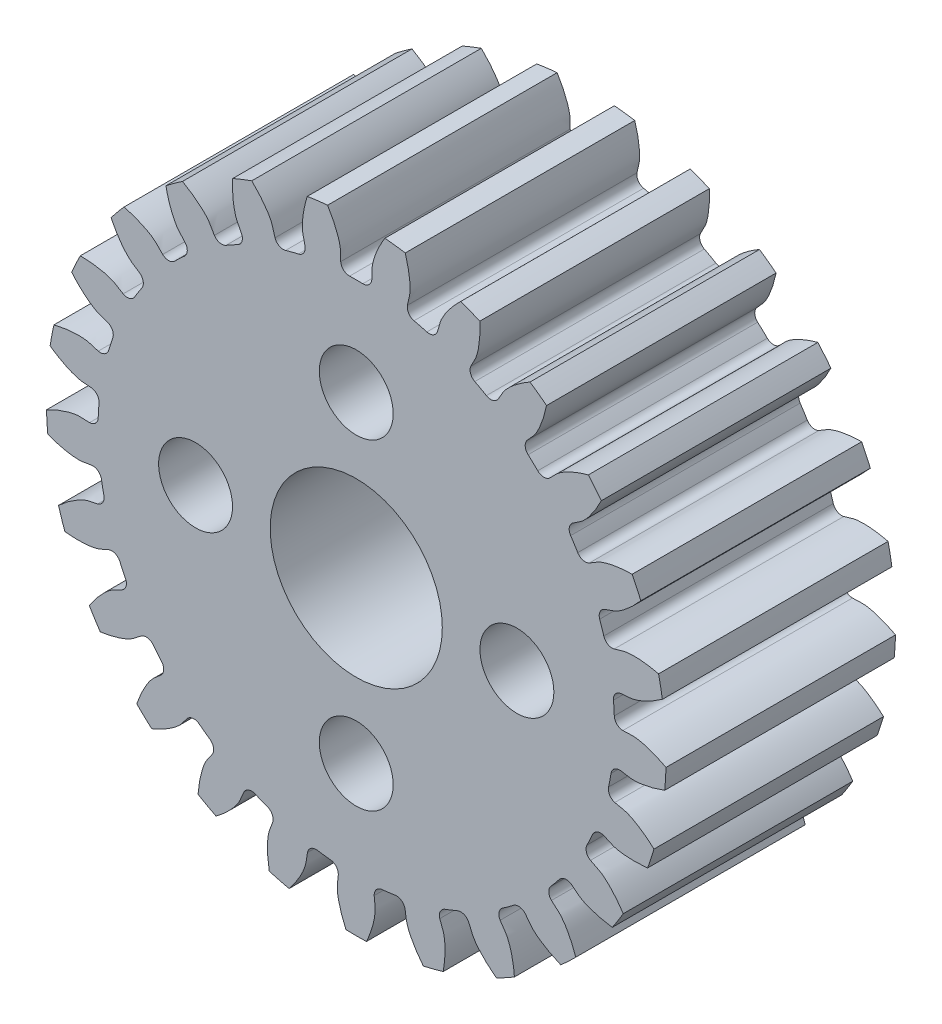
from build123d import *

# Parameters (mm, degrees)
SKETCH_1_R          = 13.5
LASHENA_DEPTH       = 10
CUT_EXTRUDEA_DEPTH  = 10
WWW_KYTOOL_CN_COUNT = 25
SKETCH_4_R          = 1.61
SKETCH_4_R_2        = 3.75
CUT_EXTRUDE_2_DEPTH = 10


with BuildPart() as part:
    # 草图1 → LaShenA (new body)
    with BuildSketch(Plane.XY):
        Circle(SKETCH_1_R)
    extrude(amount=LASHENA_DEPTH)

    # SketchA → Cut-ExtrudeA (cut)
    with BuildSketch(Plane.XY.offset(10)):
        with BuildLine():
            ThreePointArc((0.288394628, 11.246302883), (0, 11.25), (-0.288394628, 11.246302883))
            ThreePointArc((-0.288394628, 11.246302883), (-0.552990639, 11.344310851), (-0.677069573, 11.597729534))
            add(Edge.make_bspline(
                [(-0.677069573, 11.597729534), (-0.689180647, 11.759049046), (-0.675017357, 11.948139938), (-0.701115694, 12.146608536), (-0.710822654, 12.197973541), (-0.719381598, 12.238698758), (-0.730363593, 12.285443467), (-0.744009318, 12.338124262), (-0.760609842, 12.39663686), (-0.780435504, 12.460870991), (-0.803758566, 12.530705706), (-0.830845636, 12.606011004), (-0.861959653, 12.68664748), (-0.897358901, 12.772466597), (-0.937296937, 12.863310771), (-0.982022255, 12.959013534), (-1.031778021, 13.059399677), (-1.086801808, 13.164285408), (-1.147325325, 13.273478522), (-1.213574156, 13.386778576), (-1.285767526, 13.503977062), (-1.364117951, 13.62485761), (-1.479472427, 13.794169673), (-1.572316715, 13.920638011), (-1.637338255, 14.005233377)],
                knots=[0.123705737, 0.123705737, 0.123705737, 0.123705737, 0.284026838, 0.310496331, 0.322146932, 0.335915822, 0.351803004, 0.369808477, 0.38993224, 0.412174294, 0.436534639, 0.463013274, 0.491610201, 0.522325418, 0.555158926, 0.590110724, 0.627180814, 0.666369194, 0.707675866, 0.751100828, 0.796644081, 0.844305624, 0.894085459, 1, 1, 1, 1], degree=3))
            ThreePointArc((-1.637338255, 14.005233377), (0, 14.100618373), (1.637338255, 14.005233377))
            add(Edge.make_bspline(
                [(0.677069573, 11.597729534), (0.689180647, 11.759049046), (0.675017357, 11.948139938), (0.701115694, 12.146608536), (0.710822654, 12.197973541), (0.719381598, 12.238698758), (0.730363593, 12.285443467), (0.744009318, 12.338124262), (0.760609842, 12.39663686), (0.780435504, 12.460870991), (0.803758566, 12.530705706), (0.830845636, 12.606011004), (0.861959653, 12.68664748), (0.897358901, 12.772466597), (0.937296937, 12.863310771), (0.982022255, 12.959013534), (1.031778021, 13.059399677), (1.086801808, 13.164285408), (1.147325325, 13.273478522), (1.213574156, 13.386778576), (1.285767526, 13.503977062), (1.364117951, 13.62485761), (1.479472427, 13.794169673), (1.572316715, 13.920638011), (1.637338255, 14.005233377)],
                knots=[0.123705737, 0.123705737, 0.123705737, 0.123705737, 0.284026838, 0.310496331, 0.322146932, 0.335915822, 0.351803004, 0.369808477, 0.38993224, 0.412174294, 0.436534639, 0.463013274, 0.491610201, 0.522325418, 0.555158926, 0.590110724, 0.627180814, 0.666369194, 0.707675866, 0.751100828, 0.796644081, 0.844305624, 0.894085459, 1, 1, 1, 1], degree=3))
            ThreePointArc((0.677069573, 11.597729534), (0.552990639, 11.344310851), (0.288394628, 11.246302883))
        make_face()
    cut_extrudea = extrude(amount=-CUT_EXTRUDEA_DEPTH, mode=Mode.SUBTRACT)

    # www.KYTool.cn: Cut-ExtrudeA ×25 about axis
    www_kytool_cn_axis = Axis((0, 0, -88.99), (0, 0, 1))
    for i in range(1, WWW_KYTOOL_CN_COUNT):
        add(cut_extrudea.rotate(www_kytool_cn_axis, i * 360 / WWW_KYTOOL_CN_COUNT), mode=Mode.SUBTRACT)

    # 草图4 → 切除-拉伸2 (cut)
    with BuildSketch(Plane.XY.offset(10)):
        with Locations((0, 7)):
            Circle(SKETCH_4_R)
        with Locations((7, 0)):
            Circle(SKETCH_4_R)
        with Locations((0, -7)):
            Circle(SKETCH_4_R)
        with Locations((-7, 0)):
            Circle(SKETCH_4_R)
        Circle(SKETCH_4_R_2)
    extrude(amount=-CUT_EXTRUDE_2_DEPTH, mode=Mode.SUBTRACT)


solid = part.part
